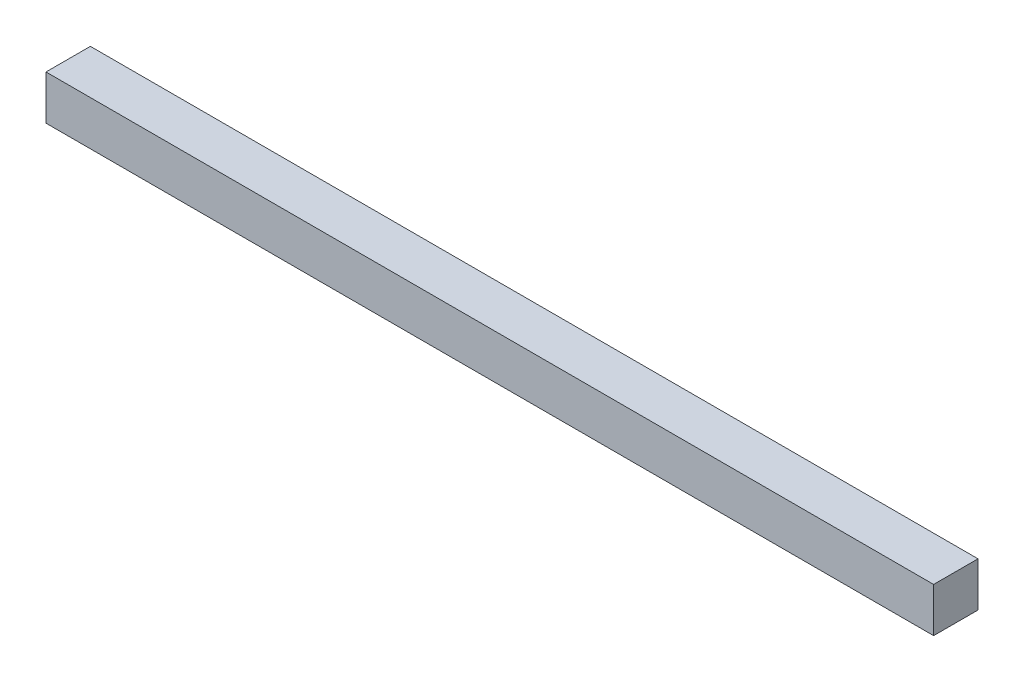
from build123d import *

# Parameters (mm, degrees)
SKETCH_1_W      = 50
SKETCH_1_H      = 50
EXTRUDE_1_DEPTH = 1000


with BuildPart() as part:
    # Эскиз1 → Бобышка-Вытянуть1 (new body)
    with BuildSketch(Plane(origin=(0, 0, 0), x_dir=(0, 0, -1), z_dir=(1, 0, 0))):
        with Locations((-8.454314317, -2.359923725)):
            Rectangle(SKETCH_1_W, SKETCH_1_H)
    extrude(amount=EXTRUDE_1_DEPTH)


solid = part.part
